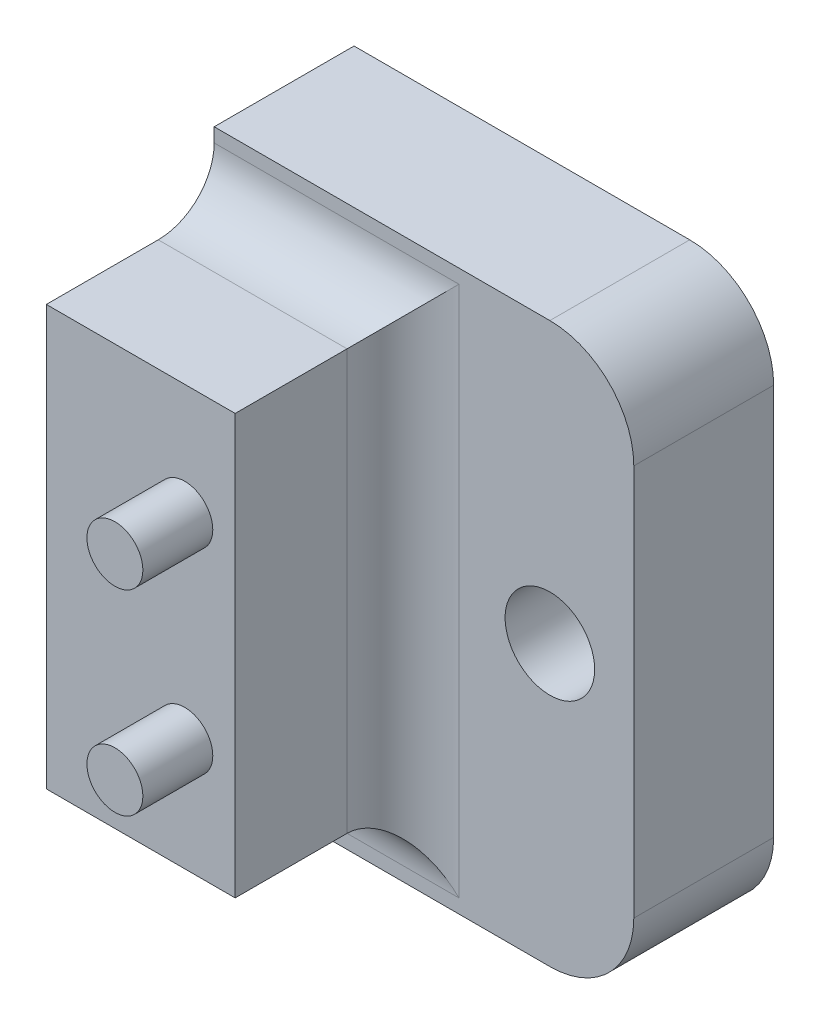
from build123d import *

# Parameters (mm, degrees)
CROQUIS1_R              = 1.6
SALIENTE_EXTRUIR1_DEPTH = 5
CROQUIS2_W              = 6.75
CROQUIS2_H              = 15
SALIENTE_EXTRUIR2_DEPTH = 6
REDONDEO1_R             = 2
CROQUIS3_R              = 1
SALIENTE_EXTRUIR3_DEPTH = 2.5


with BuildPart() as part:
    # Croquis1 → Saliente-Extruir1 (new body)
    with BuildSketch(Plane.XY):
        with BuildLine():
            Line((0, 0), (12, 0))
            ThreePointArc((12, 0), (14.121320344, 0.878679656), (15, 3))
            Line((15, 3), (15, 17))
            ThreePointArc((15, 17), (14.121320344, 19.121320344), (12, 20))
            Line((12, 20), (0, 20))
            Line((0, 20), (0, 0))
        make_face()
        with Locations((12, 10)):
            Circle(CROQUIS1_R, mode=Mode.SUBTRACT)
    extrude(amount=SALIENTE_EXTRUIR1_DEPTH)

    # Croquis2 → Saliente-Extruir2 (add)
    with BuildSketch(Plane.XY.offset(5)):
        with Locations((3.375, 10)):
            Rectangle(CROQUIS2_W, CROQUIS2_H)
    extrude(amount=SALIENTE_EXTRUIR2_DEPTH)

    # Redondeo1
    redondeo1_edges = [part.edges().sort_by_distance(p)[0] for p in [
        (3.375, 2.5, 5),
        (6.75, 10, 5),
        (3.375, 17.5, 5),
    ]]
    fillet(redondeo1_edges, radius=REDONDEO1_R)

    # Croquis3 → Saliente-Extruir3 (add)
    with BuildSketch(Plane.XY.offset(11)):
        with Locations((4.95023571, 13.5)):
            Circle(CROQUIS3_R)
        with Locations((4.95023571, 6.5)):
            Circle(CROQUIS3_R)
    extrude(amount=SALIENTE_EXTRUIR3_DEPTH)


solid = part.part
